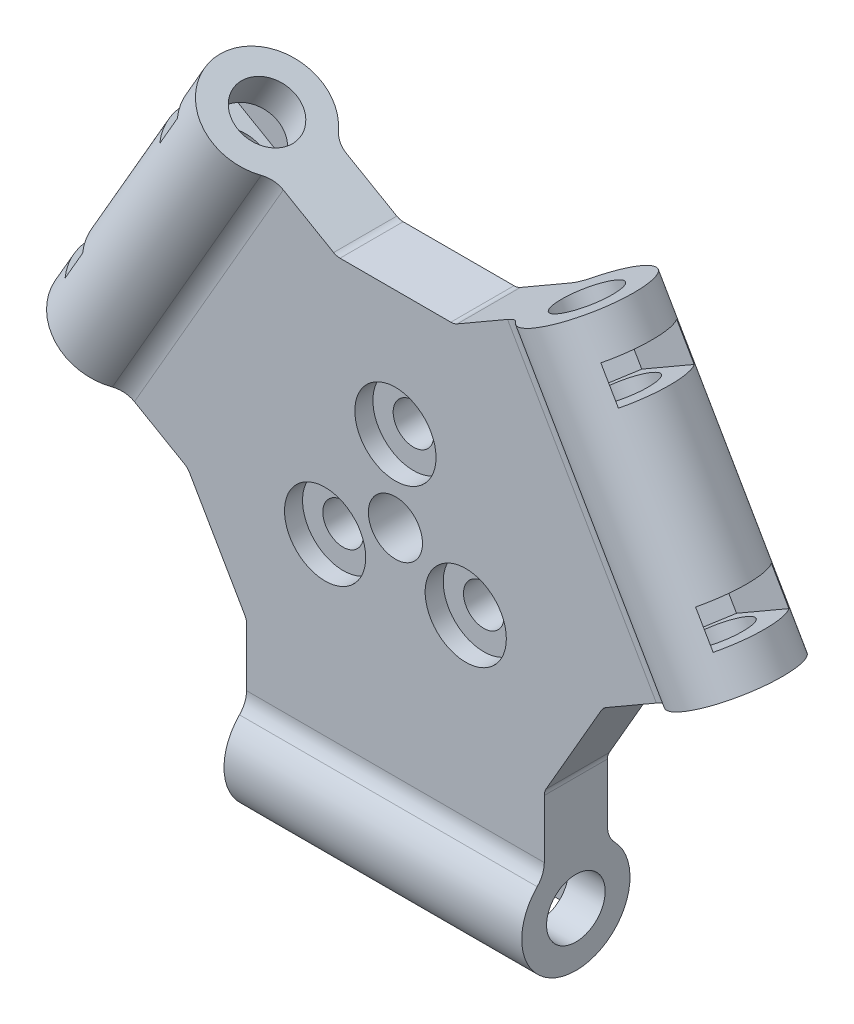
from build123d import *

# Parameters (mm, degrees)
SKETCH_2_R                   = 6
EXTRUDE_1_DEPTH              = 16.5
SKETCH_3_R                   = 3.25
CUT_EXTRUDE_1_DEPTH          = 13
CUT_EXTRUDE_START            = -13
SKETCH_4_R                   = 3.25
CUT_EXTRUDE_2_DEPTH          = 13
EXTRUDE_2_DEPTH              = 16.5
CUT_EXTRUDE_4_DEPTH          = 1.95
CUT_EXTRUDE_4_DEPTH_BACK     = 1.95
CUT_EXTRUDE_5_DEPTH          = 1.95
CUT_EXTRUDE_5_DEPTH_BACK     = 1.95
PATTERN_CIRCULAR_1_COUNT     = 3
EXTRUDE_3_DEPTH              = 3.5
CUT_EXTRUDE_3_DEPTH          = 54.725986169
CUT_EXTRUDE_3_DEPTH_BACK     = 54.725986169
SKETCH_9_R                   = 3
HOLE_WIZARD_M4_1_D           = 4.5
HOLE_WIZARD_M4_1_CBORE_D     = 9
HOLE_WIZARD_M4_1_CBORE_DEPTH = 2


with BuildPart() as part:
    # 스케치2 → 보스-돌출1 (new, symmetric)
    with BuildSketch(Plane(origin=(0, 0, 0), x_dir=(0, 0, -1), z_dir=(1, 0, 0))):
        with Locations((0, -30)):
            Circle(SKETCH_2_R)
    extrude(amount=EXTRUDE_1_DEPTH, both=True)

    # 스케치3 → 컷-돌출1 (cut)
    with BuildSketch(Plane(origin=(16.5, 0, 0), x_dir=(0, 0, -1), z_dir=(1, 0, 0))):
        with Locations((0, -30)):
            Circle(SKETCH_3_R)
    extrude(amount=-CUT_EXTRUDE_1_DEPTH, mode=Mode.SUBTRACT)

    # 스케치4 → 컷-돌출2 (cut)
    with BuildSketch(Plane.ZY.offset(16.5).offset(CUT_EXTRUDE_START)):
        with Locations(Location((0, -30, 0), (0, 0, 180))):
            Circle(SKETCH_4_R)
    extrude(amount=CUT_EXTRUDE_2_DEPTH, mode=Mode.SUBTRACT)

    # 스케치6 → 보스-돌출2 (add, symmetric)
    with BuildSketch(Plane(origin=(0, 0, 0), x_dir=(0, 0, -1), z_dir=(1, 0, 0))):
        with BuildLine():
            Line((-3.5, -23.876275643), (-3.5, -22))
            Line((-3.5, -22), (3.5, -22))
            Line((3.5, -22), (3.5, -23.876275643))
            ThreePointArc((3.5, -23.876275643), (3.703994726, -24.915677944), (4.285714286, -25.800874727))
            Line((4.285714286, -25.800874727), (-4.285714286, -25.800874727))
            ThreePointArc((-4.285714286, -25.800874727), (-3.703994726, -24.915677944), (-3.5, -23.876275643))
        make_face()
    extrude(amount=EXTRUDE_2_DEPTH, both=True)

    # 스케치12 → 컷-돌출4 (cut, two sides: drawn at the far end of the back side and taken through both)
    with BuildSketch(Plane.ZY.offset(10.5).offset(-CUT_EXTRUDE_4_DEPTH_BACK)):
        Polygon((-4.2, -36), (4.2, -36), (4.2, -32.424871131), (0, -34.849742261), (-4.2, -32.424871131), align=None)
        Polygon((-4.2, -27.575128869), (-4.2, -32.424871131), (0, -34.849742261), (4.2, -32.424871131), (4.2, -27.575128869), (0, -25.150257739), align=None)
    extrude(amount=CUT_EXTRUDE_4_DEPTH + CUT_EXTRUDE_4_DEPTH_BACK, mode=Mode.SUBTRACT)

    # 스케치13 → 컷-돌출5 (cut, two sides: drawn at the far end of the back side and taken through both)
    with BuildSketch(Plane(origin=(10.5, 0, 0), x_dir=(0, 0, -1), z_dir=(1, 0, 0)).offset(-CUT_EXTRUDE_5_DEPTH_BACK)):
        with BuildLine():
            Line((-4.2, -27.575128869), (-4.2, -34.284857057))
            ThreePointArc((-4.2, -34.284857057), (0, -36), (4.2, -34.284857057))
            Line((4.2, -34.284857057), (4.2, -27.575128869))
            Line((4.2, -27.575128869), (0, -25.150257739))
            Line((0, -25.150257739), (-4.2, -27.575128869))
        make_face()
    extrude(amount=CUT_EXTRUDE_5_DEPTH + CUT_EXTRUDE_5_DEPTH_BACK, mode=Mode.SUBTRACT)


with BuildPart() as pattern_circular_1_1:
    # 원형 패턴1: pattern copy
    add(part.part.rotate(Axis((0, 0, 0), (0, 0, 1)), 1 * 360 / PATTERN_CIRCULAR_1_COUNT))


with BuildPart() as pattern_circular_1_2:
    # 원형 패턴1: pattern copy
    add(part.part.rotate(Axis((0, 0, 0), (0, 0, 1)), 2 * 360 / PATTERN_CIRCULAR_1_COUNT))


with BuildPart() as part_1:
    add(part.part)

    add(pattern_circular_1_1.part)  # 보스-돌출3 merges 원형 패턴1_1

    add(pattern_circular_1_2.part)  # 보스-돌출3 merges 원형 패턴1_2
    # 스케치8 → 보스-돌출3 (add, symmetric)
    with BuildSketch(Plane.XY):
        with BuildLine():
            Line((16.5, -22), (-16.5, -22))
            Line((-16.5, -22), (-16.5, -17.434263876))
            ThreePointArc((-16.5, -17.434263876), (-16.548246013, -17.067799022), (-16.689696167, -16.726308143))
            Line((-16.689696167, -16.726308143), (-22.830255847, -6.090546791))
            ThreePointArc((-22.830255847, -6.090546791), (-23.055270547, -5.797301924), (-23.348515413, -5.572287224))
            Line((-23.348515413, -5.572287224), (-27.302558883, -3.289419162))
            Line((-27.302558883, -3.289419162), (-10.802558883, 25.289419162))
            Line((-10.802558883, 25.289419162), (-6.848515413, 23.0065511))
            ThreePointArc((-6.848515413, 23.0065511), (-6.507024533, 22.865100947), (-6.14055968, 22.816854933))
            Line((-6.14055968, 22.816854933), (6.14055968, 22.816854933))
            ThreePointArc((6.14055968, 22.816854933), (6.507024533, 22.865100947), (6.848515413, 23.0065511))
            Line((6.848515413, 23.0065511), (10.802558883, 25.289419162))
            Line((10.802558883, 25.289419162), (27.302558883, -3.289419162))
            Line((27.302558883, -3.289419162), (23.348515413, -5.572287224))
            ThreePointArc((23.348515413, -5.572287224), (23.055270547, -5.797301924), (22.830255847, -6.090546791))
            Line((22.830255847, -6.090546791), (16.689696167, -16.726308143))
            ThreePointArc((16.689696167, -16.726308143), (16.548246013, -17.067799022), (16.5, -17.434263876))
            Line((16.5, -17.434263876), (16.5, -22))
        make_face()
    extrude(amount=EXTRUDE_3_DEPTH, both=True)

    # 스케치9 → 컷-돌출3 (cut, two sides: drawn at the far end of the back side and taken through both)
    with BuildSketch(Plane.XY.offset(-CUT_EXTRUDE_3_DEPTH_BACK)):
        Circle(SKETCH_9_R)
    extrude(amount=CUT_EXTRUDE_3_DEPTH + CUT_EXTRUDE_3_DEPTH_BACK, mode=Mode.SUBTRACT)

    # M4 남비 머리 나사용 카운터보어1 (through all)
    with Locations(Plane.XY.offset(3.5)):
        with Locations((0, 9), (7.794228634, -4.5), (-7.794228634, -4.5)):
            CounterBoreHole(HOLE_WIZARD_M4_1_D / 2, HOLE_WIZARD_M4_1_CBORE_D / 2, HOLE_WIZARD_M4_1_CBORE_DEPTH)


solid = part_1.part
